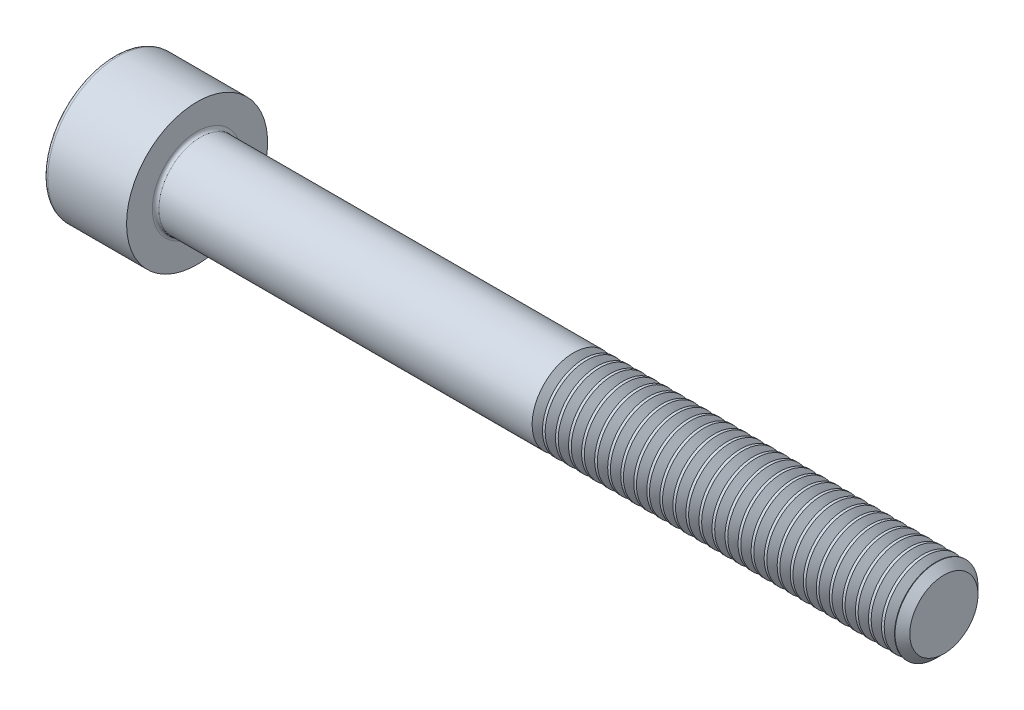
from build123d import *

# Parameters (mm, degrees)
FILLET1_R       = 0.2
FILLET2_R       = 0.25
HEX_2_DEPTH     = 2.5
THDSCHPAT_COUNT = 28
THDSCHPAT_PITCH = 0.785714286


with BuildPart() as part:
    # BodySke → Base-Revolve (revolve)
    with BuildSketch(Plane.XY, mode=Mode.PRIVATE) as base_revolve_sk:
        Polygon((0, 0), (0, 4.25), (5, 4.25), (5, 2.5), (49.555, 2.5), (50, 2.055), (50, 0), align=None)
    revolve(base_revolve_sk.sketch.rotate(Axis((-31.75, 0, 0), (1, 0, 0)), 90), axis=Axis((-31.75, 0, 0), (1, 0, 0)))

    # Fillet1
    fillet1_edges = [part.edges().sort_by_distance(p)[0] for p in [
        (5, 0, -2.5),
    ]]
    fillet(fillet1_edges, radius=FILLET1_R)

    # Fillet2
    fillet2_edges = [part.edges().sort_by_distance(p)[0] for p in [
        (0, 0, -4.25),
    ]]
    fillet(fillet2_edges, radius=FILLET2_R)

    # Sketch2 → Hex-PreBroach (revolve, cut)
    with BuildSketch(Plane.XY, mode=Mode.PRIVATE) as hex_prebroach_sk:
        Polygon((0, 2.042), (2.5, 2.042), (3.67894925, 0), (0, 0), align=None)
    revolve(hex_prebroach_sk.sketch.rotate(Axis((0, 0, 0), (1, 0, 0)), 90), axis=Axis((0, 0, 0), (1, 0, 0)), mode=Mode.SUBTRACT)

    # Sketch3 → Hex 2 (cut)
    with BuildSketch(Plane(origin=(0, 0, 0), x_dir=(0, 0.500000000000001, 0.866025403784438), z_dir=(-1, 0, 0))):
        Polygon((1.17894925, 2.042), (-1.17894925, 2.042), (-2.357898499, 0), (-1.17894925, -2.042), (1.17894925, -2.042), (2.357898499, 0), align=None)
    extrude(amount=-HEX_2_DEPTH, mode=Mode.SUBTRACT)

    # ThdSchSke → ThreadSchematic (revolve, cut)
    with BuildSketch(Plane.XY):
        Polygon((28, -2.055), (27.688407645, -2.5), (27.688407645, -3.125), (28.311592355, -3.125), (28.311592355, -2.5), align=None)
    threadschematic = revolve(axis=Axis((-3.175, 0, 0), (1, 0, 0)), mode=Mode.SUBTRACT)

    # ThdSchPat: ThreadSchematic ×28
    with Locations(*[(i * THDSCHPAT_PITCH, 0, 0) for i in range(1, THDSCHPAT_COUNT)]):
        add(threadschematic, mode=Mode.SUBTRACT)


solid = part.part
